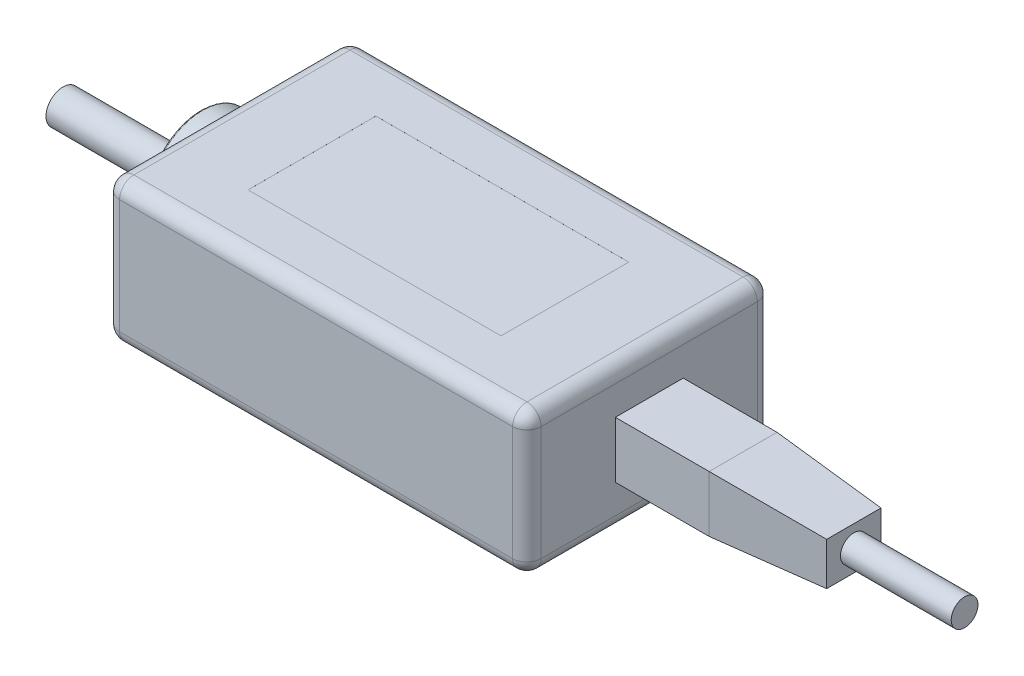
from build123d import *
from OCP.BRepFilletAPI import BRepFilletAPI_MakeFillet

# Parameters (mm, degrees)
SKETCH1_W           = 59.944
SKETCH1_H           = 34.798
BOSS_EXTRUDE1_DEPTH = 10.16
FILLET1_R           = 2.032
SKETCH2_R           = 7.62
BOSS_EXTRUDE2_DEPTH = 3.81
FILLET2_R1          = 0.254
FILLET2_R2          = 0.762
SKETCH3_R           = 2.413
BOSS_EXTRUDE3_DEPTH = 17.78
SKETCH4_W           = 9.652
SKETCH4_H           = 8.001
BOSS_EXTRUDE4_DEPTH = 13.335
SKETCH5_W           = 9.652
SKETCH5_H           = 8.001
BOSS_EXTRUDE5_DEPTH = 15.748
BOSS_EXTRUDE5_TAPER = 3.5
SKETCH6_R           = 1.905
BOSS_EXTRUDE6_DEPTH = 15.748
SKETCH7_W           = 35.955959778
SKETCH7_H           = 18.169743528
CUT_EXTRUDE1_DEPTH  = 0.00254


with BuildPart() as part:
    # Sketch1 → Boss-Extrude1 (new, symmetric)
    with BuildSketch(Plane(origin=(0, 0, 0), x_dir=(1, 0, 0), z_dir=(0, 1, 0))):
        Rectangle(SKETCH1_W, SKETCH1_H)
    extrude(amount=BOSS_EXTRUDE1_DEPTH, both=True)

    # Fillet1
    fillet1_edges = [part.edges().sort_by_distance(p)[0] for p in [
        (-29.972, 0, -17.399),
        (0, -10.16, -17.399),
        (-29.972, -10.16, 0),
        (29.972, 0, -17.399),
        (29.972, -10.16, 0),
        (-29.972, 0, 17.399),
        (29.972, 0, 17.399),
        (0, -10.16, 17.399),
        (0, 10.16, 17.399),
        (-29.972, 10.16, 0),
        (0, 10.16, -17.399),
        (29.972, 10.16, 0),
    ]]
    fillet(fillet1_edges, radius=FILLET1_R)

    # Sketch2 → Boss-Extrude2 (add)
    with BuildSketch(Plane.ZY.offset(29.972)):
        Circle(SKETCH2_R)
    extrude(amount=BOSS_EXTRUDE2_DEPTH)

    # Fillet2: one fillet with a radius per group of edges: ONE call of the kernel's fillet builder (fillet() takes one radius for all edges)
    fillet2_edges_1 = [part.edges().sort_by_distance(p)[0] for p in [
        (-33.782, 0, -7.62),
    ]]
    fillet2_edges_2 = [part.edges().sort_by_distance(p)[0] for p in [
        (-29.972, 0, -7.62),
    ]]
    fillet2 = BRepFilletAPI_MakeFillet(part.part.solid().wrapped)
    for e in fillet2_edges_1:
        fillet2.Add(FILLET2_R1, e.wrapped)
    for e in fillet2_edges_2:
        fillet2.Add(FILLET2_R2, e.wrapped)
    add(Compound.cast(fillet2.Shape()), mode=Mode.REPLACE)

    # Sketch3 → Boss-Extrude3 (add)
    with BuildSketch(Plane.ZY.offset(33.782)):
        with Locations((1.819787166, 0)):
            Circle(SKETCH3_R)
    extrude(amount=BOSS_EXTRUDE3_DEPTH)

    # Sketch4 → Boss-Extrude4 (add)
    with BuildSketch(Plane(origin=(29.972, 0, 0), x_dir=(0, 0, -1), z_dir=(1, 0, 0))):
        Rectangle(SKETCH4_W, SKETCH4_H)
    extrude(amount=BOSS_EXTRUDE4_DEPTH)

    # Sketch5 → Boss-Extrude5 (add)
    with BuildSketch(Plane(origin=(43.307, 0, 0), x_dir=(0, 0, -1), z_dir=(1, 0, 0))):
        Rectangle(SKETCH5_W, SKETCH5_H)
    extrude(amount=BOSS_EXTRUDE5_DEPTH, taper=BOSS_EXTRUDE5_TAPER)

    # Sketch6 → Boss-Extrude6 (add)
    with BuildSketch(Plane(origin=(59.055, 0, 0), x_dir=(0, 0, -1), z_dir=(1, 0, 0))):
        Circle(SKETCH6_R)
    extrude(amount=BOSS_EXTRUDE6_DEPTH)

    # Sketch7 → Cut-Extrude1 (cut)
    with BuildSketch(Plane(origin=(0, 10.16, 0), x_dir=(1, 0, 0), z_dir=(0, 1, 0))):
        Rectangle(SKETCH7_W, SKETCH7_H)
    extrude(amount=-CUT_EXTRUDE1_DEPTH, mode=Mode.SUBTRACT)


solid = part.part
